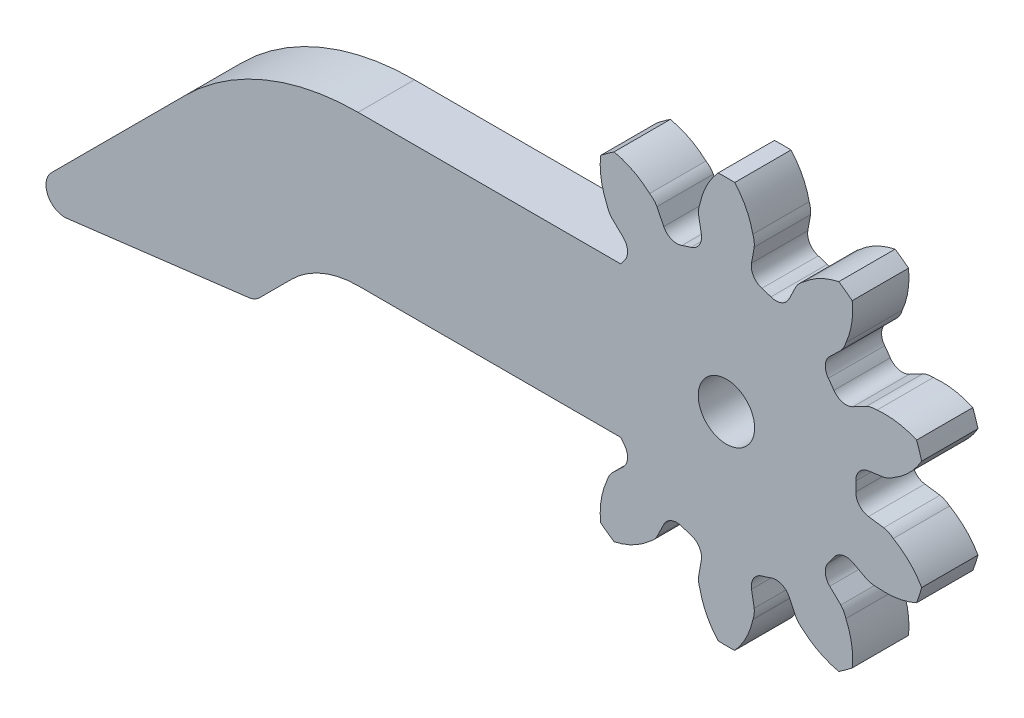
from build123d import *

# Parameters (mm, degrees)
POSICIONAMENTOS_R               = 6.8994
BASE_DEPTH                      = 3
BASE_DENTE_DEPTH                = 3
RAIO_DENTE_R                    = 0.778916794
PADR_OCIRCULAR1_COUNT           = 10
RAIO_DENTE_OF_PADR_OCIRCULAR1_R = 0.778916794
RESSALTO_EXTRUS_O3_DEPTH        = 3
FURO_DE_DI_METRO_3_0_3_1_D      = 3
FILETE2_R                       = 5
FILETE3_R                       = 13
FILETE4_R                       = 1


with BuildPart() as part:
    # Posicionamentos → Base (new body)
    with BuildSketch(Plane.XY):
        Circle(POSICIONAMENTOS_R)
    extrude(amount=BASE_DEPTH)

    # Dente → Base Dente (add, through all)
    with BuildSketch(Plane.XY):
        with BuildLine():
            Line((1.480256779, 8.326682401), (1.207591527, 6.792896515))
            ThreePointArc((1.207591527, 6.792896515), (0, 6.8994), (-1.207591527, 6.792896515))
            Line((-1.207591527, 6.792896515), (-1.480256779, 8.326682401))
            ThreePointArc((-1.480256779, 8.326682401), (-1.476621376, 8.612123538), (-1.407910185, 8.889195065))
            ThreePointArc((-1.407910185, 8.889195065), (-1.05050148, 9.903958065), (-0.441648539, 10.79096597))
            ThreePointArc((-0.441648539, 10.79096597), (0, 10.8), (0.441648539, 10.79096597))
            ThreePointArc((0.441648539, 10.79096597), (1.05050148, 9.903958065), (1.407910185, 8.889195065))
            ThreePointArc((1.407910185, 8.889195065), (1.476621376, 8.612123538), (1.480256779, 8.326682401))
        make_face()
    base_dente = extrude(amount=BASE_DENTE_DEPTH)

    # Raio Dente
    raio_dente_edges = [part.edges().sort_by_distance(p)[0] for p in [
        (-1.207591527, 6.792896515, 1.5),
        (1.207591527, 6.792896515, 1.5),
    ]]
    fillet(raio_dente_edges, radius=RAIO_DENTE_R)

    # PadrãoCircular1: Base Dente ×10 about axis, 2 skipped
    padr_ocircular1_axis = Axis((0, 0, 0), (0, 0, -1))
    add([base_dente.rotate(padr_ocircular1_axis, i * 360 / PADR_OCIRCULAR1_COUNT) for i in range(1, PADR_OCIRCULAR1_COUNT) if i not in (7, 8)])

    # Raio Dente of PadrãoCircular1
    raio_dente_of_padr_ocircular1_edges = [part.edges().sort_by_distance(p)[0] for p in [
        (3.015802325, 6.205373212, 1.5),
        (4.969726459, 4.785764232, 1.5),
        (6.087262191, 3.247608255, 1.5),
        (6.833594799, 0.950632674, 1.5),
        (6.833594799, -0.950632674, 1.5),
        (6.087262191, -3.247608255, 1.5),
        (4.969726459, -4.785764232, 1.5),
        (3.015802325, -6.205373212, 1.5),
        (1.207591527, -6.792896515, 1.5),
        (-1.207591527, -6.792896515, 1.5),
        (-3.015802325, -6.205373212, 1.5),
        (-4.969726459, -4.785764232, 1.5),
        (-4.969726459, 4.785764232, 1.5),
        (-3.015802325, 6.205373212, 1.5),
    ]]
    fillet(raio_dente_of_padr_ocircular1_edges, radius=RAIO_DENTE_OF_PADR_OCIRCULAR1_R)

    # Braço → Ressalto-extrusão3 (add, through all)
    with BuildSketch(Plane.XY):
        Polygon((0, 4), (-25, 4), (-38, -9), (-25.102702489, -7.416410988), (-21.686291501, -4), (0, -4), align=None)
    extrude(amount=RESSALTO_EXTRUS_O3_DEPTH)

    # Furo de diâmetro Ø3.0 (3)1 (through all)
    with Locations(Plane.XY.offset(3)):
        with Locations((0, 0)):
            Hole(FURO_DE_DI_METRO_3_0_3_1_D / 2)

    # Filete2
    filete2_edges = [part.edges().sort_by_distance(p)[0] for p in [
        (-21.686291501, -4, 1.5),
    ]]
    fillet(filete2_edges, radius=FILETE2_R)

    # Filete3
    filete3_edges = [part.edges().sort_by_distance(p)[0] for p in [
        (-25, 4, 1.5),
    ]]
    fillet(filete3_edges, radius=FILETE3_R)

    # Filete4
    filete4_edges = [part.edges().sort_by_distance(p)[0] for p in [
        (-25.102702489, -7.416410988, 1.5),
        (-38, -9, 1.5),
    ]]
    fillet(filete4_edges, radius=FILETE4_R)


solid = part.part
